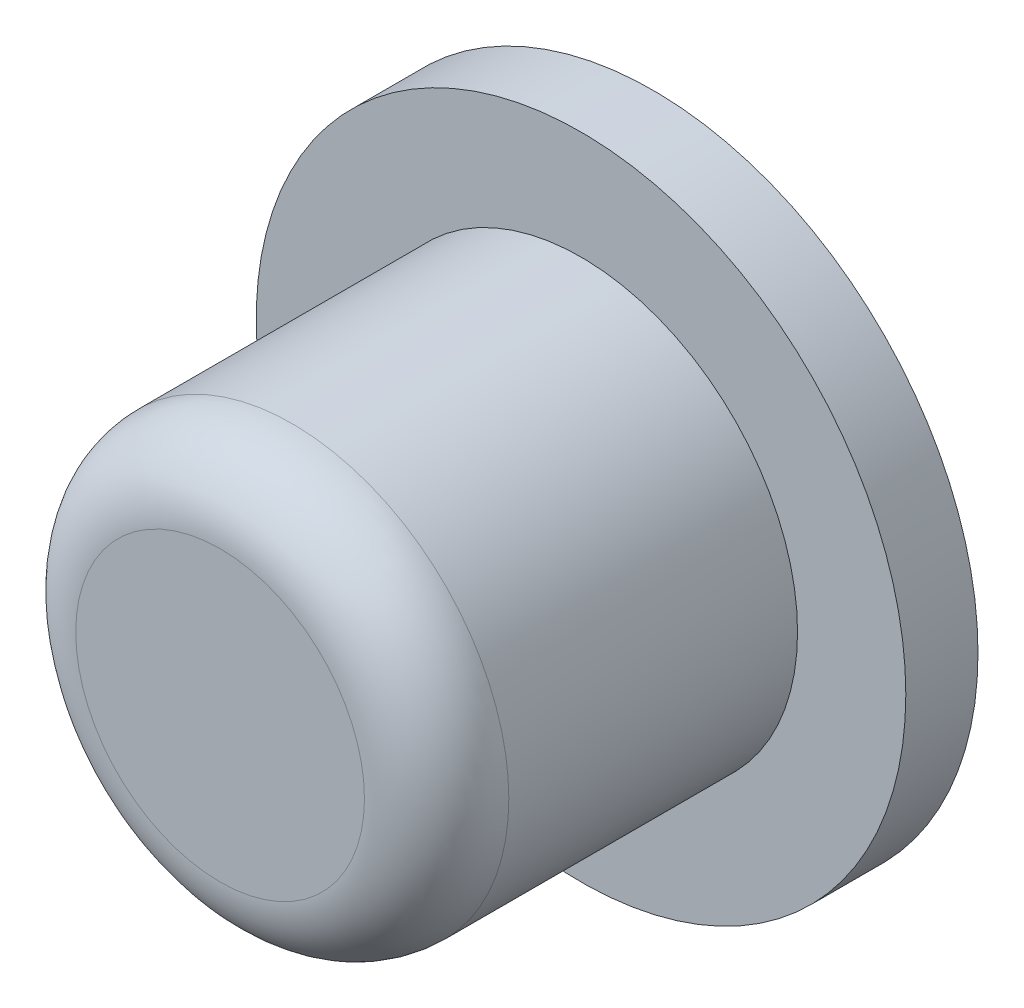
from build123d import *

# Parameters (mm, degrees)
SKETCH_1_R          = 3
EXTRUDE_1_DEPTH     = 6
SKETCH_1_4_R        = 1.9
CUT_EXTRUDE_1_DEPTH = 2
SKETCH_1_5_R        = 4.5
SKETCH_1_5_R_2      = 3
EXTRUDE_2_DEPTH     = 1
FILLET_1_R          = 1


with BuildPart() as part:
    # 草图1 → 凸台-拉伸1 (new body)
    with BuildSketch(Plane.XY):
        Circle(SKETCH_1_R)
    extrude(amount=EXTRUDE_1_DEPTH)

    # 草图1<4> → 切除-拉伸1 (cut)
    with BuildSketch(Plane.XY):
        Circle(SKETCH_1_4_R)
    extrude(amount=CUT_EXTRUDE_1_DEPTH, mode=Mode.SUBTRACT)

    # 草图1<5> → 凸台-拉伸2 (add)
    with BuildSketch(Plane.XY):
        Circle(SKETCH_1_5_R)
        Circle(SKETCH_1_5_R_2, mode=Mode.SUBTRACT)
    extrude(amount=EXTRUDE_2_DEPTH)

    # 圆角1
    fillet_1_edges = [part.edges().sort_by_distance(p)[0] for p in [
        (-3, 0, 6),
    ]]
    fillet(fillet_1_edges, radius=FILLET_1_R)


solid = part.part
